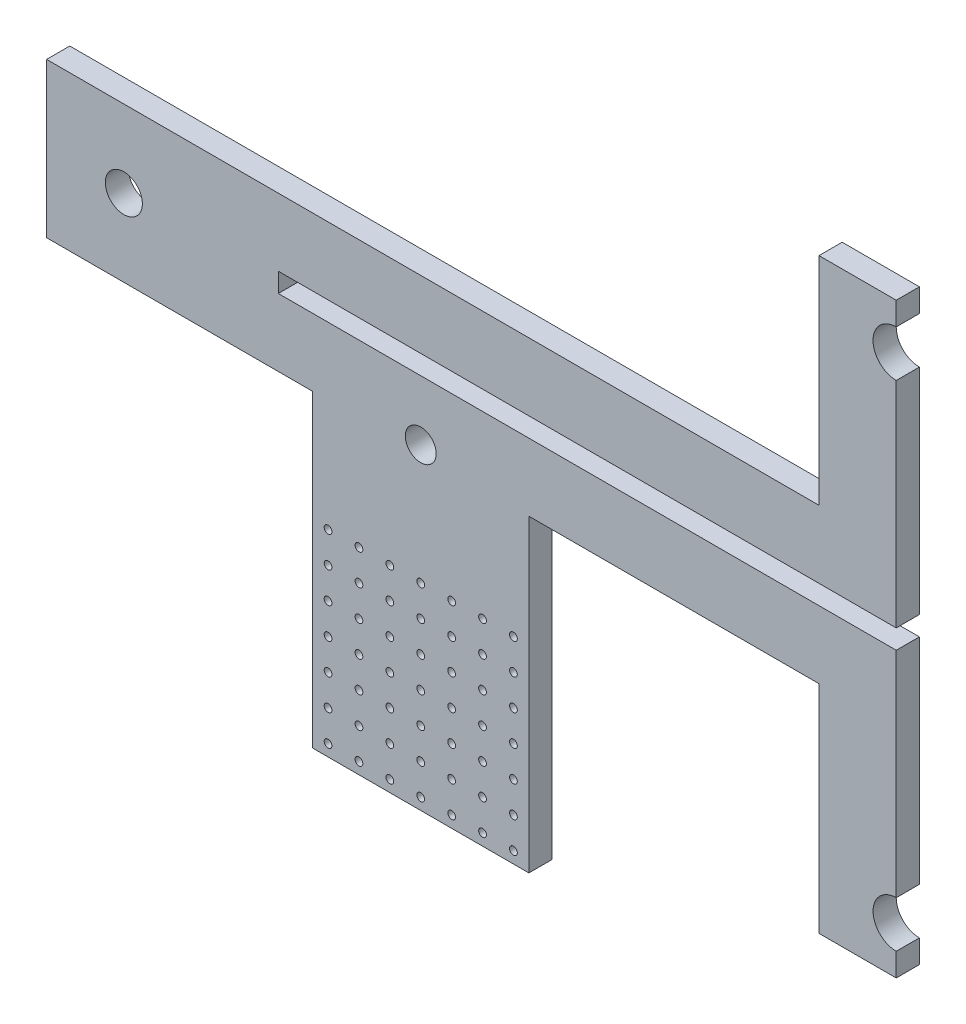
from build123d import *

# Parameters (mm, degrees)
SKETCH1_R           = 1.2
BOSS_EXTRUDE1_DEPTH = 1.5
CUT_EXTRUDE2_DEPTH  = 40
SKETCH2_R           = 0.25
CUT_EXTRUDE4_DEPTH  = 1.5
SKETCH4_R           = 1
CUT_EXTRUDE5_DEPTH  = 1.5


with BuildPart() as part:
    # Sketch1 → Boss-Extrude1 (new body)
    with BuildSketch(Plane.XY):
        with BuildLine():
            ThreePointArc((50, -17.5), (48.5, -16), (50, -14.5))
            Line((50, -14.5), (50, 14.5))
            ThreePointArc((50, 14.5), (48.5, 16), (50, 17.5))
            Line((50, 17.5), (50, 19))
            Line((50, 19), (45, 19))
            Line((45, 19), (45, 5))
            Line((45, 5), (-5, 5))
            Line((-5, 5), (-5, 0))
            Line((-5, 0), (-5, -5))
            Line((-5, -5), (12.22, -5))
            Line((12.22, -5), (12.22, -25))
            Line((12.22, -25), (19.22, -25))
            Line((19.22, -25), (26.22, -25))
            Line((26.22, -25), (26.22, -5))
            Line((26.22, -5), (45, -5))
            Line((45, -5), (45, -19))
            Line((45, -19), (50, -19))
            Line((50, -19), (50, -17.5))
        make_face()
        Circle(SKETCH1_R, mode=Mode.SUBTRACT)
    extrude(amount=BOSS_EXTRUDE1_DEPTH)

    # Sketch3 → Cut-Extrude2 (cut)
    with BuildSketch(Plane(origin=(50, 0, 0), x_dir=(0, 0, -1), z_dir=(1, 0, 0))):
        Polygon((0, 0), (0, -0.625), (-1.5, -0.625), (-1.5, 0.625), (0, 0.625), align=None)
    extrude(amount=-CUT_EXTRUDE2_DEPTH, mode=Mode.SUBTRACT)

    # Sketch2 → Cut-Extrude4 (cut)
    with BuildSketch(Plane.XY.offset(1.5)):
        with Locations((21.22, -24.25)):
            Circle(SKETCH2_R)
        with Locations((19.22, -20.25)):
            Circle(SKETCH2_R)
        with Locations((21.22, -20.25)):
            Circle(SKETCH2_R)
        with Locations((23.22, -20.25)):
            Circle(SKETCH2_R)
        with Locations((23.22, -24.25)):
            Circle(SKETCH2_R)
        with Locations((25.22, -20.25)):
            Circle(SKETCH2_R)
        with Locations((25.22, -18.25)):
            Circle(SKETCH2_R)
        with Locations((23.22, -18.25)):
            Circle(SKETCH2_R)
        with Locations((23.22, -16.25)):
            Circle(SKETCH2_R)
        with Locations((15.22, -24.25)):
            Circle(SKETCH2_R)
        with Locations((21.22, -22.25)):
            Circle(SKETCH2_R)
        with Locations((19.22, -24.25)):
            Circle(SKETCH2_R)
        with Locations((19.22, -22.25)):
            Circle(SKETCH2_R)
        with Locations((19.22, -18.25)):
            Circle(SKETCH2_R)
        with Locations((19.22, -16.25)):
            Circle(SKETCH2_R)
        with Locations((19.22, -14.25)):
            Circle(SKETCH2_R)
        with Locations((19.22, -12.25)):
            Circle(SKETCH2_R)
        with Locations((21.22, -12.25)):
            Circle(SKETCH2_R)
        with Locations((21.22, -14.25)):
            Circle(SKETCH2_R)
        with Locations((21.22, -16.25)):
            Circle(SKETCH2_R)
        with Locations((21.22, -18.25)):
            Circle(SKETCH2_R)
        with Locations((23.22, -22.25)):
            Circle(SKETCH2_R)
        with Locations((25.22, -24.25)):
            Circle(SKETCH2_R)
        with Locations((25.22, -22.25)):
            Circle(SKETCH2_R)
        with Locations((25.22, -16.25)):
            Circle(SKETCH2_R)
        with Locations((23.22, -12.25)):
            Circle(SKETCH2_R)
        with Locations((25.22, -12.25)):
            Circle(SKETCH2_R)
        with Locations((23.22, -14.25)):
            Circle(SKETCH2_R)
        with Locations((25.22, -14.25)):
            Circle(SKETCH2_R)
        with Locations((17.22, -24.25)):
            Circle(SKETCH2_R)
        with Locations((17.22, -22.25)):
            Circle(SKETCH2_R)
        with Locations((17.22, -20.25)):
            Circle(SKETCH2_R)
        with Locations((17.22, -18.25)):
            Circle(SKETCH2_R)
        with Locations((17.22, -16.25)):
            Circle(SKETCH2_R)
        with Locations((17.22, -14.25)):
            Circle(SKETCH2_R)
        with Locations((17.22, -12.25)):
            Circle(SKETCH2_R)
        with Locations((15.22, -22.25)):
            Circle(SKETCH2_R)
        with Locations((15.22, -20.25)):
            Circle(SKETCH2_R)
        with Locations((15.22, -18.25)):
            Circle(SKETCH2_R)
        with Locations((15.22, -16.25)):
            Circle(SKETCH2_R)
        with Locations((15.22, -14.25)):
            Circle(SKETCH2_R)
        with Locations((15.22, -12.25)):
            Circle(SKETCH2_R)
        with Locations((13.22, -12.25)):
            Circle(SKETCH2_R)
        with Locations((13.22, -14.25)):
            Circle(SKETCH2_R)
        with Locations((13.22, -16.25)):
            Circle(SKETCH2_R)
        with Locations((13.22, -18.25)):
            Circle(SKETCH2_R)
        with Locations((13.22, -20.25)):
            Circle(SKETCH2_R)
        with Locations((13.22, -22.25)):
            Circle(SKETCH2_R)
        with Locations((13.22, -24.25)):
            Circle(SKETCH2_R)
    extrude(amount=-CUT_EXTRUDE4_DEPTH, mode=Mode.SUBTRACT)

    # Sketch4 → Cut-Extrude5 (cut)
    with BuildSketch(Plane.XY.offset(1.5)):
        with Locations((19.22, -4.5)):
            Circle(SKETCH4_R)
    extrude(amount=-CUT_EXTRUDE5_DEPTH, mode=Mode.SUBTRACT)


solid = part.part
